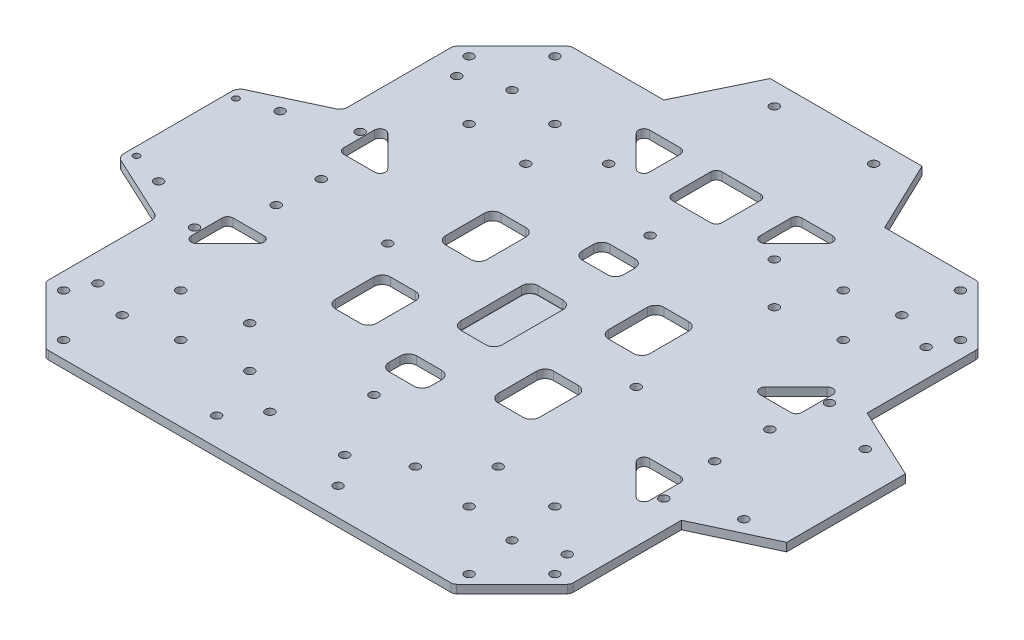
from build123d import *

# Parameters (mm, degrees)
SKETCH_1_R             = 1.6
EXTRUDE_1_DEPTH        = 3
FILLET_1_R             = 2
SKETCH_2_W             = 18
SKETCH_2_H             = 18
CUT_EXTRUDE_1_DEPTH    = 135.383778783
FILLET_2_R             = 2
EXTRUDE_2_DEPTH        = 3
FILLET_3_R             = 3
SKETCH_5_R             = 1.6
SKETCH_5_W             = 15
SKETCH_5_H             = 20
SKETCH_5_H_2           = 28
SKETCH_5_H_3           = 10
CUT_EXTRUDE_3_DEPTH    = 10
FILLET_4_R             = 3
SKETCH_6_R             = 1.15
CUT_EXTRUDE_8568_DEPTH = 10
SKETCH_7_R             = 1.6
EXTRUDE_3_DEPTH        = 3
SKETCH_8_R             = 1.6
CUT_EXTRUDE_4_DEPTH    = 40
SKETCH_9_R             = 1.6
CUT_EXTRUDE_5_DEPTH    = 10
EXTRUDE_4_DEPTH        = 3
SKETCH_11_W            = 25
SKETCH_11_H            = 35
EXTRUDE_5_DEPTH        = 3
FILLET_5_R             = 3


with BuildPart() as part:
    # 草图1 → 凸台-拉伸1 (new body)
    with BuildSketch(Plane(origin=(0, 0, 0), x_dir=(1, 0, 0), z_dir=(0, 1, 0))):
        Polygon((95, -73.786796564), (95, 73.786796564), (73.786796564, 95), (-73.786796564, 95), (-95, 73.786796564), (-95, -73.786796564), (-73.786796564, -95), (73.786796564, -95), align=None)
        with Locations(Location((-88.98959236, -73.433243174, 0), (0, 0, 270))):
            Circle(SKETCH_1_R, mode=Mode.SUBTRACT)
        with Locations(Location((-73.433243174, -88.98959236, 0), (0, 0, 270))):
            Circle(SKETCH_1_R, mode=Mode.SUBTRACT)
        with Locations(Location((-73.433243174, 88.98959236, 0), (0, 0, 270))):
            Circle(SKETCH_1_R, mode=Mode.SUBTRACT)
        with Locations(Location((-88.98959236, 73.433243174, 0), (0, 0, 270))):
            Circle(SKETCH_1_R, mode=Mode.SUBTRACT)
        with Locations(Location((73.433243174, 88.98959236, 0), (0, 0, 270))):
            Circle(SKETCH_1_R, mode=Mode.SUBTRACT)
        with Locations(Location((88.98959236, 73.433243174, 0), (0, 0, 270))):
            Circle(SKETCH_1_R, mode=Mode.SUBTRACT)
        with Locations(Location((88.98959236, -73.433243174, 0), (0, 0, 270))):
            Circle(SKETCH_1_R, mode=Mode.SUBTRACT)
        with Locations(Location((73.433243174, -88.98959236, 0), (0, 0, 270))):
            Circle(SKETCH_1_R, mode=Mode.SUBTRACT)
        with Locations(Location((-67.776388924, -52.220039738, 0), (0, 0, 270))):
            Circle(SKETCH_1_R, mode=Mode.SUBTRACT)
        with Locations(Location((-52.220039738, -67.776388924, 0), (0, 0, 270))):
            Circle(SKETCH_1_R, mode=Mode.SUBTRACT)
        with Locations(Location((67.776388924, -52.220039738, 0), (0, 0, 270))):
            Circle(SKETCH_1_R, mode=Mode.SUBTRACT)
        with Locations(Location((52.220039738, -67.776388924, 0), (0, 0, 270))):
            Circle(SKETCH_1_R, mode=Mode.SUBTRACT)
        with Locations(Location((67.776388924, 52.220039738, 0), (0, 0, 270))):
            Circle(SKETCH_1_R, mode=Mode.SUBTRACT)
        with Locations(Location((52.220039738, 67.776388924, 0), (0, 0, 270))):
            Circle(SKETCH_1_R, mode=Mode.SUBTRACT)
        with Locations(Location((-67.776388924, 52.220039738, 0), (0, 0, 270))):
            Circle(SKETCH_1_R, mode=Mode.SUBTRACT)
        with Locations(Location((-52.220039738, 67.776388924, 0), (0, 0, 270))):
            Circle(SKETCH_1_R, mode=Mode.SUBTRACT)
        with Locations(Location((-70.604816049, -70.604816049, 0), (0, 0, 270))):
            Circle(SKETCH_1_R, mode=Mode.SUBTRACT)
        with Locations(Location((-70.604816049, 70.604816049, 0), (0, 0, 270))):
            Circle(SKETCH_1_R, mode=Mode.SUBTRACT)
        with Locations(Location((70.604816049, -70.604816049, 0), (0, 0, 270))):
            Circle(SKETCH_1_R, mode=Mode.SUBTRACT)
        with Locations(Location((70.604816049, 70.604816049, 0), (0, 0, 270))):
            Circle(SKETCH_1_R, mode=Mode.SUBTRACT)
    extrude(amount=EXTRUDE_1_DEPTH)

    # 圆角1
    fillet_1_edges = [part.edges().sort_by_distance(p)[0] for p in [
        (-73.786796564, 1.5, 95),
        (-95, 1.5, 73.786796564),
        (-95, 1.5, -73.786796564),
        (-73.786796564, 1.5, -95),
        (73.786796564, 1.5, -95),
        (95, 1.5, -73.786796564),
        (95, 1.5, 73.786796564),
        (73.786796564, 1.5, 95),
    ]]
    fillet(fillet_1_edges, radius=FILLET_1_R)

    # 草图2 → 切除-拉伸1 (cut, through all)
    with BuildSketch(Plane(origin=(0, 3, 0), x_dir=(1, 0, 0), z_dir=(0, 1, 0))):
        Polygon((-65, 20), (-83, 38), (-83, 20), align=None)
        Polygon((-83, -38), (-83, -20), (-65, -20), align=None)
        Polygon((20, 65), (38, 83), (20, 83), align=None)
        Polygon((-38, 83), (-20, 83), (-20, 65), align=None)
        with Locations((0, 74)):
            Rectangle(SKETCH_2_W, SKETCH_2_H)
        Polygon((65, -20), (83, -38), (83, -20), align=None)
        Polygon((83, 38), (83, 20), (65, 20), align=None)
    extrude(amount=-CUT_EXTRUDE_1_DEPTH, mode=Mode.SUBTRACT)

    # 圆角2
    fillet_2_edges = [part.edges().sort_by_distance(p)[0] for p in [
        (65, 1.5, -20),
        (83, 1.5, -38),
        (83, 1.5, -20),
        (65, 1.5, 20),
        (83, 1.5, 20),
        (83, 1.5, 38),
        (-65, 1.5, 20),
        (-83, 1.5, 38),
        (-83, 1.5, 20),
        (20, 1.5, -65),
        (20, 1.5, -83),
        (38, 1.5, -83),
        (-20, 1.5, -65),
        (-38, 1.5, -83),
        (-20, 1.5, -83),
        (9, 1.5, -83),
        (9, 1.5, -65),
        (-9, 1.5, -65),
        (-9, 1.5, -83),
        (-65, 1.5, -20),
        (-83, 1.5, -20),
        (-83, 1.5, -38),
    ]]
    fillet(fillet_2_edges, radius=FILLET_2_R)

    # 草图4 → 凸台-拉伸2 (add)
    with BuildSketch(Plane(origin=(0, 3, 0), x_dir=(1, 0, 0), z_dir=(0, 1, 0))):
        Polygon((-121, -21.5), (-95, -33.623999112), (-95, -21.5), (-95, 21.5), (-95, 33.623999112), (-121, 21.5), align=None)
        Polygon((95, 33.623999112), (95, 21.5), (95, -21.5), (95, -33.623999112), (121, -21.5), (121, 21.5), align=None)
    extrude(amount=-EXTRUDE_2_DEPTH)

    # 圆角3
    fillet_3_edges = [part.edges().sort_by_distance(p)[0] for p in [
        (-95, 1.5, 33.623999112),
        (-121, 1.5, 21.5),
        (-121, 1.5, -21.5),
        (-95, 1.5, -33.623999112),
    ]]
    fillet(fillet_3_edges, radius=FILLET_3_R)

    # 草图5 → 切除-拉伸3 (cut)
    with BuildSketch(Plane.XZ):
        with Locations(Location((-106, 22, 0), (0, 0, 90))):
            Circle(SKETCH_5_R)
        with Locations(Location((-106, -22, 0), (0, 0, 270))):
            Circle(SKETCH_5_R)
        with Locations(Location((106, -22, 0), (0, 0, 90))):
            Circle(SKETCH_5_R)
        with Locations(Location((106, 22, 0), (0, 0, 270))):
            Circle(SKETCH_5_R)
        with Locations(Location((82.5, -10.895903559, 0), (0, 0, 270))):
            Circle(SKETCH_5_R)
        with Locations(Location((82.5, 9.104096441, 0), (0, 0, 270))):
            Circle(SKETCH_5_R)
        with Locations(Location((-77.25, 8.16, 0), (0, 0, 270))):
            Circle(SKETCH_5_R)
        with Locations(Location((-77.25, -8.16, 0), (0, 0, 90))):
            Circle(SKETCH_5_R)
        with Locations(Location((13.55, 74.15, 0), (0, 0, 270))):
            Circle(SKETCH_5_R)
        with Locations(Location((-13.55, 74.15, 0), (0, 0, 270))):
            Circle(SKETCH_5_R)
        with Locations((-29.5, -20)):
            Rectangle(SKETCH_5_W, SKETCH_5_H)
        Rectangle(SKETCH_5_W, SKETCH_5_H_2)
        with Locations((-29.5, 20)):
            Rectangle(SKETCH_5_W, SKETCH_5_H)
        with Locations((29.5, 20)):
            Rectangle(SKETCH_5_W, SKETCH_5_H)
        with Locations((29.5, -20)):
            Rectangle(SKETCH_5_W, SKETCH_5_H)
        with Locations((0, -35)):
            Rectangle(SKETCH_5_W, SKETCH_5_H_3)
        with Locations((0, 35)):
            Rectangle(SKETCH_5_W, SKETCH_5_H_3)
    extrude(amount=-CUT_EXTRUDE_3_DEPTH, mode=Mode.SUBTRACT)

    # 圆角4
    fillet_4_edges = [part.edges().sort_by_distance(p)[0] for p in [
        (-7.5, 1.5, -40),
        (-7.5, 1.5, -30),
        (7.5, 1.5, -30),
        (7.5, 1.5, -40),
        (37, 1.5, -30),
        (22, 1.5, -30),
        (22, 1.5, -10),
        (37, 1.5, -10),
        (-37, 1.5, -30),
        (-37, 1.5, -10),
        (-22, 1.5, -10),
        (-22, 1.5, -30),
        (37, 1.5, 30),
        (37, 1.5, 10),
        (22, 1.5, 10),
        (22, 1.5, 30),
        (7.5, 1.5, 40),
        (7.5, 1.5, 30),
        (-7.5, 1.5, 30),
        (-7.5, 1.5, 40),
        (7.5, 1.5, 14),
        (7.5, 1.5, -14),
        (-7.5, 1.5, -14),
        (-7.5, 1.5, 14),
        (-37, 1.5, 10),
        (-37, 1.5, 30),
        (-22, 1.5, 30),
        (-22, 1.5, 10),
    ]]
    fillet(fillet_4_edges, radius=FILLET_4_R)

    # 草图6 → Cut-Extrude 8568 (cut)
    with BuildSketch(Plane.XZ):
        with Locations(Location((-118, 18, 0), (0, 0, 270))):
            Circle(SKETCH_6_R)
        with Locations(Location((-118, -18, 0), (0, 0, 270))):
            Circle(SKETCH_6_R)
    extrude(amount=-CUT_EXTRUDE_8568_DEPTH, mode=Mode.SUBTRACT)

    # 草图7 → 凸台-拉伸3 (add)
    with BuildSketch(Plane(origin=(0, 3, 0), x_dir=(1, 0, 0), z_dir=(0, 1, 0))):
        Polygon((-40, 95), (-27.5, 121), (27.5, 121), (40, 95), align=None)
        with Locations(Location((18, 113, 0), (0, 0, 270))):
            Circle(SKETCH_7_R, mode=Mode.SUBTRACT)
        with Locations(Location((-18, 113, 0), (0, 0, 270))):
            Circle(SKETCH_7_R, mode=Mode.SUBTRACT)
    extrude(amount=-EXTRUDE_3_DEPTH)

    # 草图8 → 切除-拉伸4 (cut)
    with BuildSketch(Plane.XZ):
        with Locations(Location((22, 85, 0), (0, 0, 270))):
            Circle(SKETCH_8_R)
        with Locations(Location((-22, 85, 0), (0, 0, 270))):
            Circle(SKETCH_8_R)
    extrude(amount=-CUT_EXTRUDE_4_DEPTH, mode=Mode.SUBTRACT)

    # 草图9 → 切除-拉伸5 (cut)
    with BuildSketch(Plane.XZ):
        with Locations(Location((-45, -50, 0), (0, 0, 270))):
            Circle(SKETCH_9_R)
        with Locations(Location((45, -50, 0), (0, 0, 270))):
            Circle(SKETCH_9_R)
        with Locations(Location((0, -50, 0), (0, 0, 270))):
            Circle(SKETCH_9_R)
        with Locations(Location((-45, 0, 0), (0, 0, 270))):
            Circle(SKETCH_9_R)
        with Locations(Location((-45, 50, 0), (0, 0, 270))):
            Circle(SKETCH_9_R)
        with Locations(Location((0, 50, 0), (0, 0, 270))):
            Circle(SKETCH_9_R)
        with Locations(Location((45, 50, 0), (0, 0, 270))):
            Circle(SKETCH_9_R)
        with Locations(Location((45, 0, 0), (0, 0, 270))):
            Circle(SKETCH_9_R)
        with Locations(Location((85, 65, 0), (0, 0, 270))):
            Circle(SKETCH_9_R)
        with Locations(Location((-85, 65, 0), (0, 0, 270))):
            Circle(SKETCH_9_R)
        with Locations(Location((-85, -65, 0), (0, 0, 270))):
            Circle(SKETCH_9_R)
        with Locations(Location((85, -65, 0), (0, 0, 270))):
            Circle(SKETCH_9_R)
        with Locations(Location((30, -65, 0), (0, 0, 270))):
            Circle(SKETCH_9_R)
        with Locations(Location((-30, -65, 0), (0, 0, 270))):
            Circle(SKETCH_9_R)
        with Locations(Location((30, 65, 0), (0, 0, 270))):
            Circle(SKETCH_9_R)
        with Locations(Location((-30, 65, 0), (0, 0, 270))):
            Circle(SKETCH_9_R)
        with Locations(Location((85, 30, 0), (0, 0, 270))):
            Circle(SKETCH_9_R)
        with Locations(Location((85, -30, 0), (0, 0, 270))):
            Circle(SKETCH_9_R)
        with Locations(Location((-85, -30, 0), (0, 0, 270))):
            Circle(SKETCH_9_R)
        with Locations(Location((-85, 30, 0), (0, 0, 270))):
            Circle(SKETCH_9_R)
    extrude(amount=-CUT_EXTRUDE_5_DEPTH, mode=Mode.SUBTRACT)


with BuildPart() as body_2:
    # 草图10 → 凸台-拉伸4 (new body)
    with BuildSketch(Plane.XZ):
        with BuildLine():
            Line((7.4, -11), (7.4, 11))
            ThreePointArc((7.4, 11), (6.550609665, 13.050609665), (4.5, 13.9))
            Line((4.5, 13.9), (-4.5, 13.9))
            ThreePointArc((-4.5, 13.9), (-6.550609665, 13.050609665), (-7.4, 11))
            Line((-7.4, 11), (-7.4, -11))
            ThreePointArc((-7.4, -11), (-6.550609665, -13.050609665), (-4.5, -13.9))
            Line((-4.5, -13.9), (4.5, -13.9))
            ThreePointArc((4.5, -13.9), (6.550609665, -13.050609665), (7.4, -11))
        make_face()
    extrude(amount=EXTRUDE_4_DEPTH)

    # 草图11 → 凸台-拉伸5 (add)
    with BuildSketch(Plane.XZ.offset(3)):
        Rectangle(SKETCH_11_W, SKETCH_11_H)
    extrude(amount=EXTRUDE_5_DEPTH)

    # 圆角5
    fillet_5_edges = [body_2.edges().sort_by_distance(p)[0] for p in [
        (12.5, -4.5, -17.5),
        (12.5, -4.5, 17.5),
        (-12.5, -4.5, 17.5),
        (-12.5, -4.5, -17.5),
    ]]
    fillet(fillet_5_edges, radius=FILLET_5_R)


solid = Compound([part.part, body_2.part])
